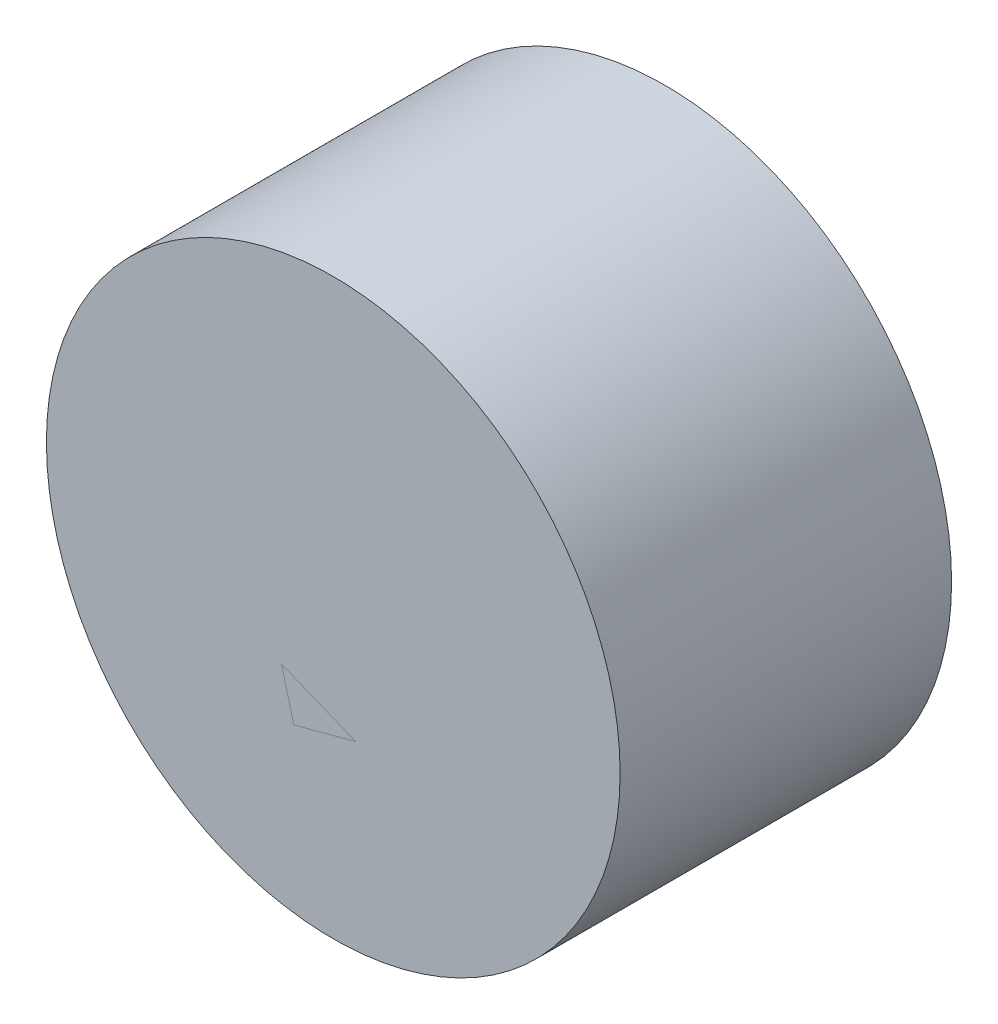
from build123d import *

# Parameters (mm, degrees)
SKETCH1_R           = 11.25
BOSS_EXTRUDE1_DEPTH = 13
SHELL1_T            = -3
SKETCH2_R           = 5
BOSS_EXTRUDE2_DEPTH = 13
SHELL2_T            = -1
BOSS_EXTRUDE3_DEPTH = 8.5


with BuildPart() as part:
    # Sketch1 → Boss-Extrude1 (new body)
    with BuildSketch(Plane.XY):
        with Locations(Location((-65.393963614, -33.455551364, 0), (0, 0, 180))):
            Circle(SKETCH1_R)
    extrude(amount=BOSS_EXTRUDE1_DEPTH)

    # Shell1
    shell1_openings = [part.faces().sort_by_distance(p)[0] for p in [
        (-65.393963614, -33.455551364, 0),
    ]]
    offset(amount=SHELL1_T, openings=shell1_openings, kind=Kind.INTERSECTION)


with BuildPart() as body_2:
    # Sketch2 → Boss-Extrude2 (new body)
    with BuildSketch(Plane.XY):
        with Locations(Location((-65.393963614, -33.455551364, 0), (0, 0, 180))):
            Circle(SKETCH2_R)
    extrude(amount=BOSS_EXTRUDE2_DEPTH)

    # Shell2
    shell2_openings = [body_2.faces().sort_by_distance(p)[0] for p in [
        (-65.393963614, -33.455551364, 0),
    ]]
    offset(amount=SHELL2_T, openings=shell2_openings, kind=Kind.INTERSECTION)


with BuildPart() as body_3:
    # Sketch4 → Boss-Extrude3 (new body)
    with BuildSketch(Plane.XY.offset(13)):
        Polygon((-67.888605191, -34.837324501), (-62.643736407, -33.250175785), (-62.973774004, -32.096308122), (-68.356811049, -33.725267908), align=None)
    extrude(amount=-BOSS_EXTRUDE3_DEPTH)


solid = Compound([part.part, body_2.part, body_3.part])
